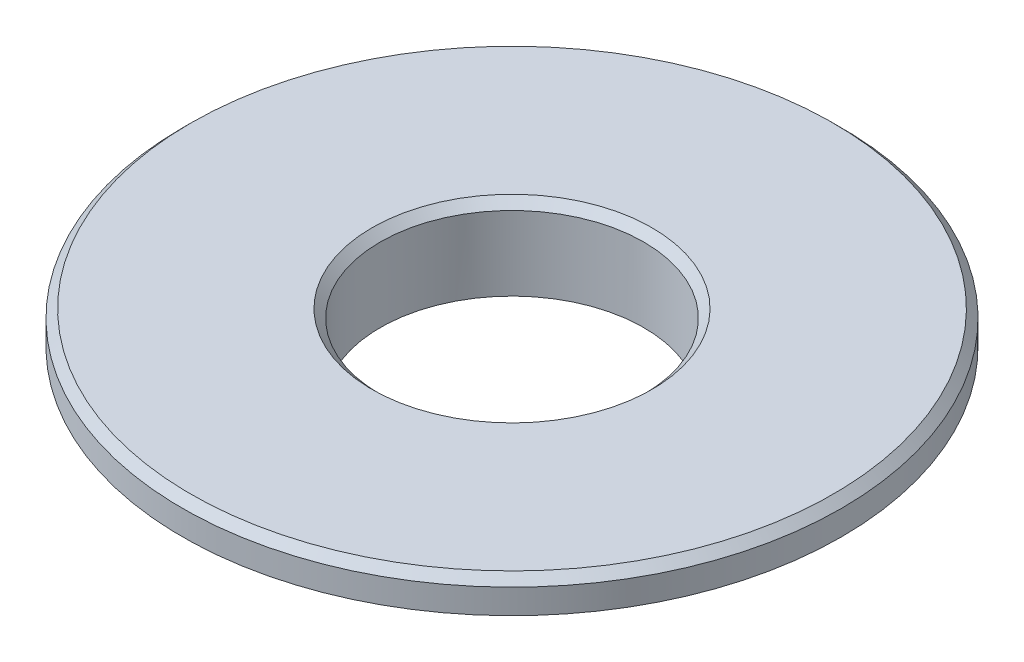
from build123d import *

# Parameters (mm, degrees)
SMUSSO1_SIZE = 0.5


with BuildPart() as part:
    # Schizzo1 → Rivoluzione1 (revolve)
    with BuildSketch(Plane.XY):
        Polygon((8, 0), (20, 0), (20, -2), (9.5, -2), (9.5, -5), (8, -5), align=None)
    revolve(axis=Axis((0, -42.973726115, 0), (0, 1, 0)))

    # Smusso1
    smusso1_edges = [part.edges().sort_by_distance(p)[0] for p in [
        (-9.5, -5, 0),
        (-20, 0, 0),
        (-8, 0, 0),
    ]]
    chamfer(smusso1_edges, length=SMUSSO1_SIZE)


solid = part.part
